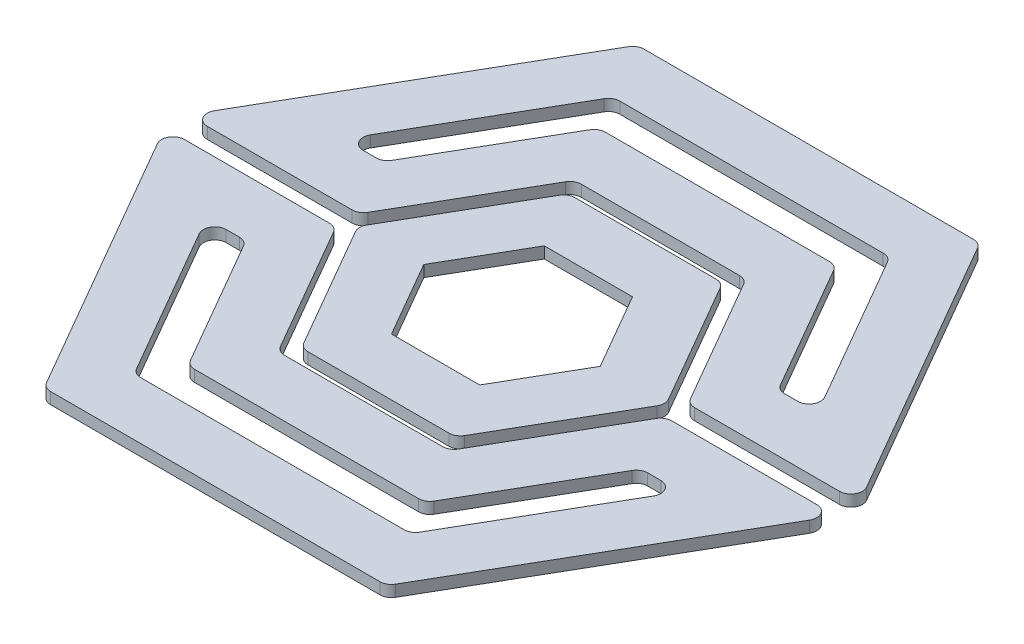
from build123d import *

# Parameters (mm, degrees)
EXTRUDE_1_DEPTH   = 2
EXTRUDE_1_2_DEPTH = 2
EXTRUDE_2_DEPTH   = 2


with BuildPart() as part:
    # 草图1 → 凸台-拉伸1 (new body)
    with BuildSketch(Plane(origin=(0, 0, 0), x_dir=(1, 0, 0), z_dir=(0, 1, 0))):
        with BuildLine():
            Line((57.113248654, 5), (30.577350269, 50.961524227))
            ThreePointArc((30.577350269, 50.961524227), (29.845299462, 51.693575035), (28.845299462, 51.961524227))
            Line((28.845299462, 51.961524227), (-28.845299462, 51.961524227))
            ThreePointArc((-28.845299462, 51.961524227), (-29.845299462, 51.693575035), (-30.577350269, 50.961524227))
            Line((-30.577350269, 50.961524227), (-57.113248654, 5))
            ThreePointArc((-57.113248654, 5), (-57.113248654, 3), (-55.381197846, 2))
            Line((-55.381197846, 2), (-30, 2))
            ThreePointArc((-30, 2), (-29, 2.267949192), (-28.267949192, 3))
            Line((-28.267949192, 3), (-15.577350269, 24.980762114))
            ThreePointArc((-15.577350269, 24.980762114), (-14.845299462, 25.712812921), (-13.845299462, 25.980762114))
            Line((-13.845299462, 25.980762114), (13.845299462, 25.980762114))
            ThreePointArc((13.845299462, 25.980762114), (14.845299462, 25.712812921), (15.577350269, 24.980762114))
            Line((15.577350269, 24.980762114), (28.267949192, 3))
            ThreePointArc((28.267949192, 3), (29, 2.267949192), (30, 2))
            Line((30, 2), (55.381197846, 2))
            ThreePointArc((55.381197846, 2), (57.113248654, 3), (57.113248654, 5))
        make_face()
        with BuildLine():
            Line((-21.350852961, 34.980762114), (-34.041451884, 13))
            ThreePointArc((-34.041451884, 13), (-34.773502692, 12.267949192), (-35.773502692, 12))
            Line((-35.773502692, 12), (-38.060689771, 12))
            ThreePointArc((-38.060689771, 12), (-39.792740578, 13), (-39.792740578, 15))
            Line((-39.792740578, 15), (-24.803847577, 40.961524227))
            ThreePointArc((-24.803847577, 40.961524227), (-24.07179677, 41.693575035), (-23.07179677, 41.961524227))
            Line((-23.07179677, 41.961524227), (23.07179677, 41.961524227))
            ThreePointArc((23.07179677, 41.961524227), (24.07179677, 41.693575035), (24.803847577, 40.961524227))
            Line((24.803847577, 40.961524227), (39.792740578, 15))
            ThreePointArc((39.792740578, 15), (39.792740578, 13), (38.060689771, 12))
            Line((38.060689771, 12), (35.773502692, 12))
            ThreePointArc((35.773502692, 12), (34.773502692, 12.267949192), (34.041451884, 13))
            Line((34.041451884, 13), (21.350852961, 34.980762114))
            ThreePointArc((21.350852961, 34.980762114), (20.618802154, 35.712812921), (19.618802154, 35.980762114))
            Line((19.618802154, 35.980762114), (-19.618802154, 35.980762114))
            ThreePointArc((-19.618802154, 35.980762114), (-20.618802154, 35.712812921), (-21.350852961, 34.980762114))
        make_face(mode=Mode.SUBTRACT)
    extrude(amount=EXTRUDE_1_DEPTH)


with BuildPart() as body_2:
    # 草图1 → Extrude 1 2 (new body)
    with BuildSketch(Plane(origin=(0, 0, 0), x_dir=(1, 0, 0), z_dir=(0, 1, 0))):
        with BuildLine():
            Line((-57.113248654, -5), (-30.577350269, -50.961524227))
            ThreePointArc((-30.577350269, -50.961524227), (-29.845299462, -51.693575035), (-28.845299462, -51.961524227))
            Line((-28.845299462, -51.961524227), (28.845299462, -51.961524227))
            ThreePointArc((28.845299462, -51.961524227), (29.845299462, -51.693575035), (30.577350269, -50.961524227))
            Line((30.577350269, -50.961524227), (57.113248654, -5))
            ThreePointArc((57.113248654, -5), (57.113248654, -3), (55.381197846, -2))
            Line((55.381197846, -2), (30, -2))
            ThreePointArc((30, -2), (29, -2.267949192), (28.267949192, -3))
            Line((28.267949192, -3), (15.577350269, -24.980762114))
            ThreePointArc((15.577350269, -24.980762114), (14.845299462, -25.712812921), (13.845299462, -25.980762114))
            Line((13.845299462, -25.980762114), (-13.845299462, -25.980762114))
            ThreePointArc((-13.845299462, -25.980762114), (-14.845299462, -25.712812921), (-15.577350269, -24.980762114))
            Line((-15.577350269, -24.980762114), (-28.267949192, -3))
            ThreePointArc((-28.267949192, -3), (-29, -2.267949192), (-30, -2))
            Line((-30, -2), (-55.381197846, -2))
            ThreePointArc((-55.381197846, -2), (-57.113248654, -3), (-57.113248654, -5))
        make_face()
        with BuildLine():
            Line((35.773502692, -12), (38.060689771, -12))
            ThreePointArc((38.060689771, -12), (39.792740578, -13), (39.792740578, -15))
            Line((39.792740578, -15), (24.803847577, -40.961524227))
            ThreePointArc((24.803847577, -40.961524227), (24.07179677, -41.693575035), (23.07179677, -41.961524227))
            Line((23.07179677, -41.961524227), (-23.07179677, -41.961524227))
            ThreePointArc((-23.07179677, -41.961524227), (-24.07179677, -41.693575035), (-24.803847577, -40.961524227))
            Line((-24.803847577, -40.961524227), (-39.792740578, -15))
            ThreePointArc((-39.792740578, -15), (-39.792740578, -13), (-38.060689771, -12))
            Line((-38.060689771, -12), (-35.773502692, -12))
            ThreePointArc((-35.773502692, -12), (-34.773502692, -12.267949192), (-34.041451884, -13))
            Line((-34.041451884, -13), (-21.350852961, -34.980762114))
            ThreePointArc((-21.350852961, -34.980762114), (-20.618802154, -35.712812921), (-19.618802154, -35.980762114))
            Line((-19.618802154, -35.980762114), (19.618802154, -35.980762114))
            ThreePointArc((19.618802154, -35.980762114), (20.618802154, -35.712812921), (21.350852961, -34.980762114))
            Line((21.350852961, -34.980762114), (34.041451884, -13))
            ThreePointArc((34.041451884, -13), (34.773502692, -12.267949192), (35.773502692, -12))
        make_face(mode=Mode.SUBTRACT)
    extrude(amount=EXTRUDE_1_2_DEPTH)


with BuildPart() as body_3:
    # 草图2 → 凸台-拉伸2 (new body)
    with BuildSketch(Plane(origin=(0, 0, 0), x_dir=(1, 0, 0), z_dir=(0, 1, 0))):
        with BuildLine():
            Line((26.422649731, 1), (14.077350269, 22.382685902))
            ThreePointArc((14.077350269, 22.382685902), (13.345299462, 23.11473671), (12.345299462, 23.382685902))
            Line((12.345299462, 23.382685902), (-12.345299462, 23.382685902))
            ThreePointArc((-12.345299462, 23.382685902), (-13.345299462, 23.11473671), (-14.077350269, 22.382685902))
            Line((-14.077350269, 22.382685902), (-26.422649731, 1))
            ThreePointArc((-26.422649731, 1), (-26.690598923, 0), (-26.422649731, -1))
            Line((-26.422649731, -1), (-14.077350269, -22.382685902))
            ThreePointArc((-14.077350269, -22.382685902), (-13.345299462, -23.11473671), (-12.345299462, -23.382685902))
            Line((-12.345299462, -23.382685902), (12.345299462, -23.382685902))
            ThreePointArc((12.345299462, -23.382685902), (13.345299462, -23.11473671), (14.077350269, -22.382685902))
            Line((14.077350269, -22.382685902), (26.422649731, -1))
            ThreePointArc((26.422649731, -1), (26.690598923, 0), (26.422649731, 1))
        make_face()
        Polygon((15.452994616, 0), (7.726497308, 13.382685902), (-7.726497308, 13.382685902), (-15.452994616, 0), (-7.726497308, -13.382685902), (7.726497308, -13.382685902), align=None, mode=Mode.SUBTRACT)
    extrude(amount=EXTRUDE_2_DEPTH)


solid = Compound([part.part, body_2.part, body_3.part])
